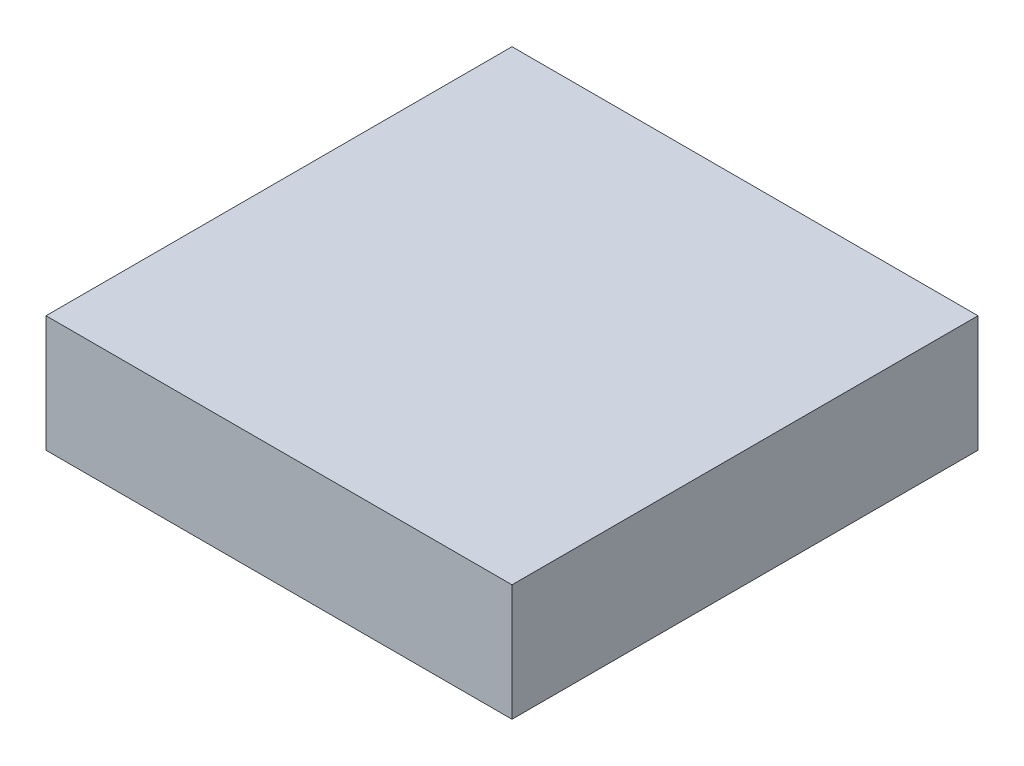
from build123d import *

# Parameters (mm, degrees)
SKETCH1_W           = 40
SKETCH1_H           = 40
BOSS_EXTRUDE1_DEPTH = 10
SKETCH2_W           = 11
SKETCH2_H           = 11
BOSS_EXTRUDE2_DEPTH = 0.5


with BuildPart() as part:
    # Sketch1 → Boss-Extrude1 (new body)
    with BuildSketch(Plane(origin=(0, 0, 0), x_dir=(1, 0, 0), z_dir=(0, 1, 0))):
        with Locations((20, 20)):
            Rectangle(SKETCH1_W, SKETCH1_H)
    extrude(amount=BOSS_EXTRUDE1_DEPTH)

    # Sketch2 → Boss-Extrude2 (add)
    with BuildSketch(Plane.XZ):
        with Locations((20, -20)):
            Rectangle(SKETCH2_W, SKETCH2_H)
    extrude(amount=BOSS_EXTRUDE2_DEPTH)


solid = part.part
